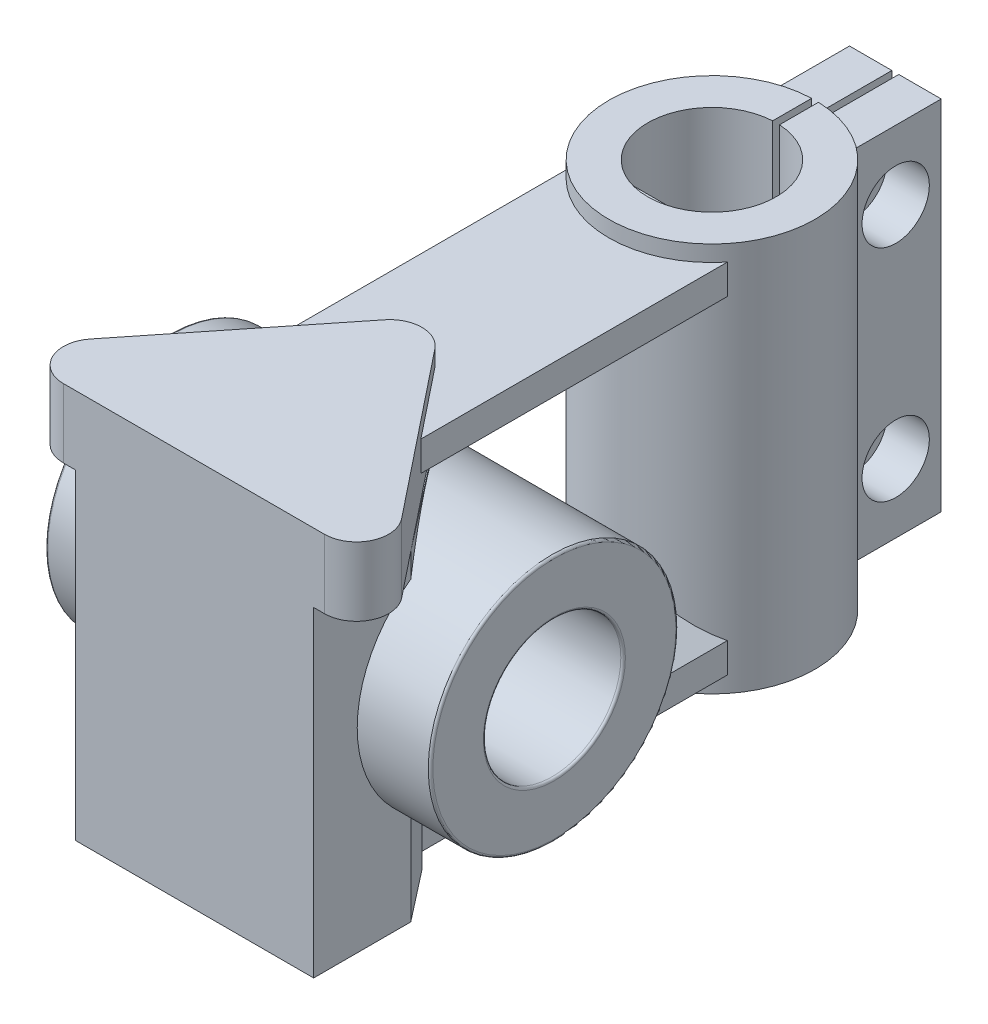
from build123d import *

# Parameters (mm, degrees)
EXTRUDE_1_DEPTH            = 78
SKETCH_3_R                 = 22.5
EXTRUDE_2_DEPTH            = 3.5
EXTRUDE_START              = 3.5
SKETCH_4_R                 = 22.5
EXTRUDE_3_DEPTH            = 3.5
SKETCH_5_W                 = 1.5
SKETCH_5_H                 = 36.764720589
CUT_EXTRUDE_1_DEPTH        = 97.598395432
SKETCH_6_R                 = 14
CUT_EXTRUDE_2_DEPTH        = 97.598395432
EXTRUDE_4_DEPTH            = 71
EXTRUDE_5_DEPTH            = 15
FILLET_1_R                 = 7
EXTRUDE_6_DEPTH            = 70
SKETCH_10_W                = 35
SKETCH_10_H                = 23.870791075
CUT_EXTRUDE_3_DEPTH        = 3.5
SKETCH_11_R                = 27
EXTRUDE_7_DEPTH            = 16
EXTRUDE_START_2            = 16
SKETCH_12_R                = 27
EXTRUDE_8_DEPTH            = 16
EXTRUDE_START_3            = 68
SKETCH_13_R                = 27
EXTRUDE_9_DEPTH            = 68
SKETCH_16_R                = 15
CUT_EXTRUDE_4_DEPTH        = 163.687584038
FILLET_2_R                 = 0.5
HOLE_WIZARD_5_8_18_1_D     = 14.68374
HOLE_WIZARD_5_8_18_1_DEPTH = 38.7985
HOLE_WIZARD_5_8_18_1_TIP   = 4.411440553


with BuildPart() as part:
    # 草图1 → 拉伸1 (new body)
    with BuildSketch(Plane(origin=(0, 0, 0), x_dir=(1, 0, 0), z_dir=(0, 1, 0))):
        with BuildLine():
            Line((-10, 20.155644371), (-10, 40))
            Line((-10, 40), (10, 40))
            Line((10, 40), (10, 20.155644371))
            ThreePointArc((10, 20.155644371), (0, -22.5), (-10, 20.155644371))
        make_face()
    extrude(amount=EXTRUDE_1_DEPTH)

    # 草图3 → 拉伸2 (add)
    with BuildSketch(Plane(origin=(0, 78, 0), x_dir=(1, 0, 0), z_dir=(0, 1, 0))):
        with Locations(Location((0, 0, 0), (0, 0, 63.612200039))):
            Circle(SKETCH_3_R)
    extrude(amount=EXTRUDE_2_DEPTH)

    # 草图4 → 拉伸3 (add)
    with BuildSketch(Plane.XZ.offset(EXTRUDE_START)):
        with Locations(Location((0, 0, 0), (0, 0, 270))):
            Circle(SKETCH_4_R)
    extrude(amount=-EXTRUDE_3_DEPTH)

    # 草图5 → 切除-拉伸1 (cut, through all)
    with BuildSketch(Plane(origin=(0, 81.5, 0), x_dir=(1, 0, 0), z_dir=(0, 1, 0))):
        with Locations((0, 23.144665006)):
            Rectangle(SKETCH_5_W, SKETCH_5_H)
    extrude(amount=-CUT_EXTRUDE_1_DEPTH, mode=Mode.SUBTRACT)

    # 草图6 → 切除-拉伸2 (cut, through all)
    with BuildSketch(Plane(origin=(0, 81.5, 0), x_dir=(1, 0, 0), z_dir=(0, 1, 0))):
        Circle(SKETCH_6_R)
    extrude(amount=-CUT_EXTRUDE_2_DEPTH, mode=Mode.SUBTRACT)

    # 草图7 → 拉伸4 (add)
    with BuildSketch(Plane.XY.offset(10)):
        Polygon((-17.5, 78), (17.5, 78), (17.5, 71.5), (0, 58), (-17.5, 71.5), align=None)
        Polygon((-17.5, 6.5), (0, 20), (17.5, 6.5), (17.5, 0), (-17.5, 0), align=None)
    extrude(amount=EXTRUDE_4_DEPTH)

    # 草图8 → 拉伸5 (add)
    with BuildSketch(Plane(origin=(0, 81.5, 0), x_dir=(1, 0, 0), z_dir=(0, 1, 0))):
        Polygon((-43, -113), (43, -113), (17.5, -81), (0, -59.039215686), (-17.5, -81), align=None)
    extrude(amount=-EXTRUDE_5_DEPTH)

    # 圆角1
    fillet_1_edges = [part.edges().sort_by_distance(p)[0] for p in [
        (-43, 74, 113),
        (0, 79.75, 59.039215686),
        (43, 74, 113),
    ]]
    fillet(fillet_1_edges, radius=FILLET_1_R)

    # 草图9 → 拉伸6 (add)
    with BuildSketch(Plane.XZ.offset(-66.5)):
        Polygon((-25.881035827, 113), (26.118964173, 113), (26.118964173, 91.81595504), (0, 58.326677723), (-25.881035827, 91.517378293), align=None)
    extrude(amount=EXTRUDE_6_DEPTH)

    # 草图10 → 切除-拉伸3 (cut)
    with BuildSketch(Plane.XZ.offset(3.5)):
        with Locations((0, 69.064604463)):
            Rectangle(SKETCH_10_W, SKETCH_10_H)
    extrude(amount=-CUT_EXTRUDE_3_DEPTH, mode=Mode.SUBTRACT)

    # 草图11 → 拉伸7 (add)
    with BuildSketch(Plane(origin=(26.118964173, 0, 0), x_dir=(0, 0, -1), z_dir=(1, 0, 0))):
        with Locations(Location((-76.5, 39, 0), (0, 0, 235.440790003))):
            Circle(SKETCH_11_R)
    extrude(amount=EXTRUDE_7_DEPTH)

    # 草图12 → 拉伸8 (add)
    with BuildSketch(Plane.ZY.offset(25.881035827).offset(EXTRUDE_START_2)):
        with Locations(Location((76.5, 39, 0), (0, 0, 304.559209997))):
            Circle(SKETCH_12_R)
    extrude(amount=-EXTRUDE_8_DEPTH)

    # 草图13 → 拉伸9 (add)
    with BuildSketch(Plane.ZY.offset(-26.118964173).offset(EXTRUDE_START_3)):
        with Locations((76.5, 39)):
            Circle(SKETCH_13_R)
    extrude(amount=-EXTRUDE_9_DEPTH)

    # 草图16 → 切除-拉伸4 (cut, through all)
    with BuildSketch(Plane(origin=(42.118964173, 0, 0), x_dir=(0, 0, -1), z_dir=(1, 0, 0))):
        with Locations((-76.5, 39)):
            Circle(SKETCH_16_R)
    extrude(amount=-CUT_EXTRUDE_4_DEPTH, mode=Mode.SUBTRACT)

    # 圆角2
    fillet_2_edges = [part.edges().sort_by_distance(p)[0] for p in [
        (42.118964173, 61.235591317, 61.18404496),
        (-41.881035827, 51.559243885, 52.598841178),
        (-41.881035827, 39, 91.5),
        (42.118964173, 39, 91.5),
    ]]
    fillet(fillet_2_edges, radius=FILLET_2_R)

    # 5/8-18 螺纹孔1
    with Locations(Plane(origin=(10, 0, 0), x_dir=(0, 0, -1), z_dir=(1, 0, 0))):
        with Locations((30.077822185, 63), (30.077822185, 15)):
            Hole(HOLE_WIZARD_5_8_18_1_D / 2, depth=HOLE_WIZARD_5_8_18_1_DEPTH)
            with Locations((0, 0, -(HOLE_WIZARD_5_8_18_1_DEPTH + HOLE_WIZARD_5_8_18_1_TIP / 2))):  # 118° drill point
                Cone(0, HOLE_WIZARD_5_8_18_1_D / 2, HOLE_WIZARD_5_8_18_1_TIP, mode=Mode.SUBTRACT)


solid = part.part
